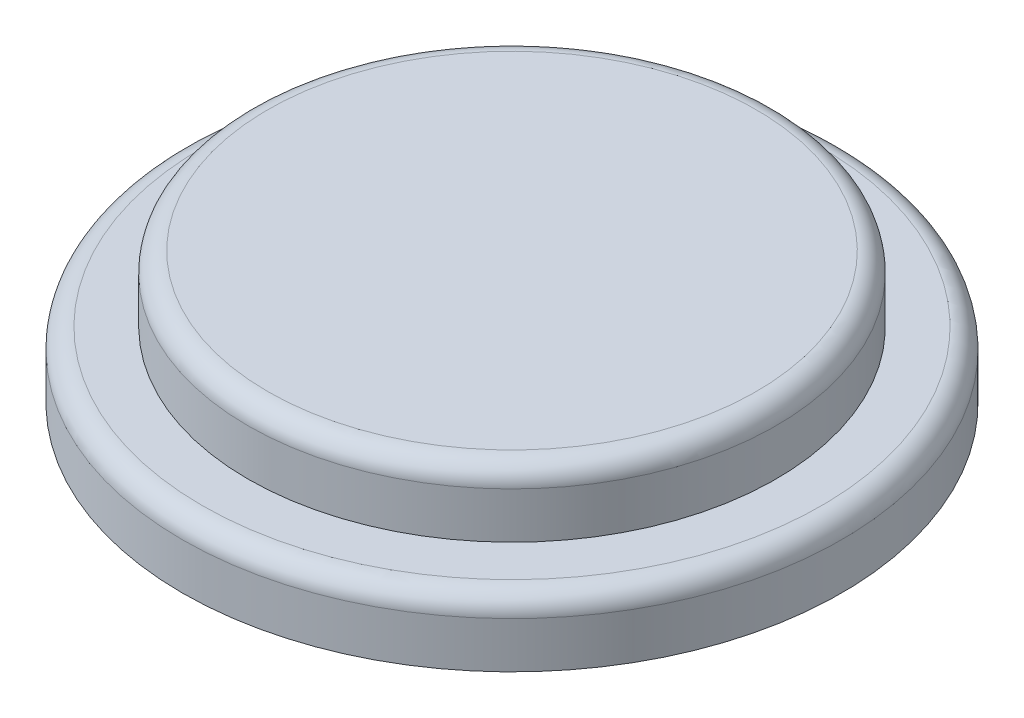
from build123d import *

# Parameters (mm, degrees)
SKETCH1_R           = 12.7
BOSS_EXTRUDE1_DEPTH = 2.54
SKETCH2_R           = 10.172184257
BOSS_EXTRUDE2_DEPTH = 2.54
FILLET1_R           = 0.762
FILLET2_R           = 0.762


with BuildPart() as part:
    # Sketch1 → Boss-Extrude1 (new body)
    with BuildSketch(Plane(origin=(0, 0, 0), x_dir=(1, 0, 0), z_dir=(0, 1, 0))):
        with Locations(Location((0, 0, 0), (0, 0, 270))):
            Circle(SKETCH1_R)
    extrude(amount=BOSS_EXTRUDE1_DEPTH)

    # Sketch2 → Boss-Extrude2 (add)
    with BuildSketch(Plane(origin=(0, 2.54, 0), x_dir=(1, 0, 0), z_dir=(0, 1, 0))):
        with Locations(Location((0, 0, 0), (0, 0, 270))):
            Circle(SKETCH2_R)
    extrude(amount=BOSS_EXTRUDE2_DEPTH)

    # Fillet1
    fillet1_edges = [part.edges().sort_by_distance(p)[0] for p in [
        (0, 2.54, -12.7),
    ]]
    fillet(fillet1_edges, radius=FILLET1_R)

    # Fillet2
    fillet2_edges = [part.edges().sort_by_distance(p)[0] for p in [
        (0, 5.08, -10.172184257),
    ]]
    fillet(fillet2_edges, radius=FILLET2_R)


solid = part.part
